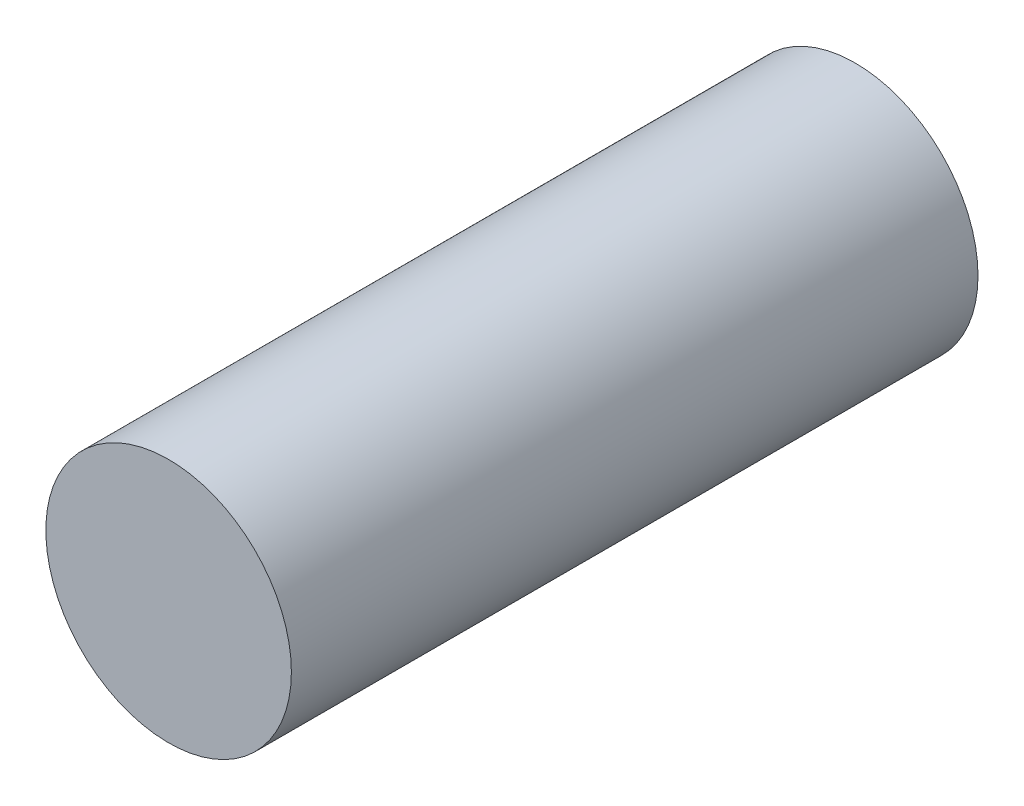
from build123d import *

# Parameters (mm, degrees)
SKETCH1_R           = 109
SKETCH1_R_2         = 100.2
BOSS_EXTRUDE1_DEPTH = 609.6
SKETCH2_R           = 100.2
BOSS_EXTRUDE2_DEPTH = 609.6


with BuildPart() as part:
    # Sketch1 → Boss-Extrude1 (new body)
    with BuildSketch(Plane.XY):
        Circle(SKETCH1_R)
        Circle(SKETCH1_R_2, mode=Mode.SUBTRACT)
    extrude(amount=BOSS_EXTRUDE1_DEPTH)

    # Sketch2 → Boss-Extrude2 (add)
    with BuildSketch(Plane(origin=(0, 0, 0), x_dir=(-1, 0, 0), z_dir=(0, 0, -1))):
        Circle(SKETCH2_R)
    extrude(amount=-BOSS_EXTRUDE2_DEPTH)


solid = part.part
